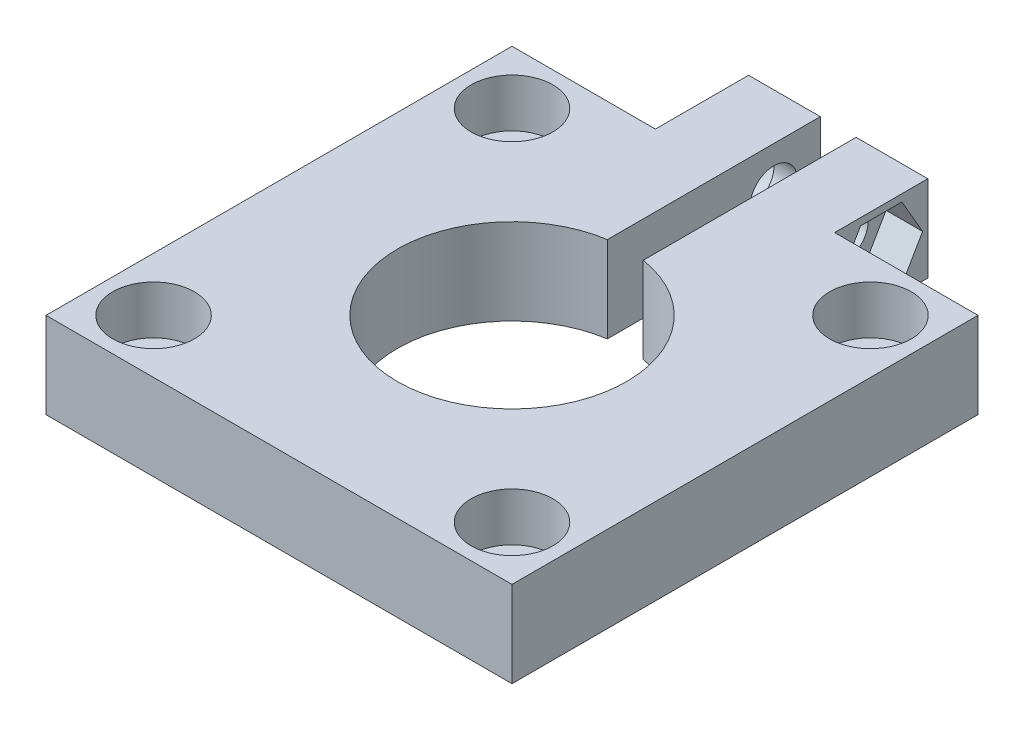
from build123d import *

# Parameters (mm, degrees)
SKETCH1_W                                           = 65
SKETCH1_H                                           = 65
BOSS_EXTRUDE1_DEPTH                                 = 12
SKETCH3_R                                           = 16
CUT_EXTRUDE1_DEPTH                                  = 12
SKETCH4_W                                           = 5
SKETCH4_H                                           = 40
CUT_EXTRUDE2_DEPTH                                  = 12
SKETCH5_W                                           = 10
SKETCH5_H                                           = 13
BOSS_EXTRUDE4_DEPTH                                 = 12
LPATTERN1_COUNT                                     = 2
LPATTERN1_PITCH                                     = 15
CBORE_FOR_M6_HEX_SOCKET_HEAD_CAP_SCREW1_D           = 6.6
CBORE_FOR_M6_HEX_SOCKET_HEAD_CAP_SCREW1_CBORE_D     = 10.5
CBORE_FOR_M6_HEX_SOCKET_HEAD_CAP_SCREW1_CBORE_DEPTH = 6.75
CUT_EXTRUDE3_DEPTH                                  = 5.1
CBORE_FOR_M6_HEX_SOCKET_HEAD_CAP_SCREW2_D           = 7.5
CBORE_FOR_M6_HEX_SOCKET_HEAD_CAP_SCREW2_CBORE_D     = 11.4
CBORE_FOR_M6_HEX_SOCKET_HEAD_CAP_SCREW2_CBORE_DEPTH = 6.75
CBORE_FOR_M6_HEX_SOCKET_HEAD_CAP_SCREW3_D           = 7.5
CBORE_FOR_M6_HEX_SOCKET_HEAD_CAP_SCREW3_CBORE_D     = 11.4
CBORE_FOR_M6_HEX_SOCKET_HEAD_CAP_SCREW3_CBORE_DEPTH = 6.75
CBORE_FOR_M6_HEX_SOCKET_HEAD_CAP_SCREW4_D           = 7.5
CBORE_FOR_M6_HEX_SOCKET_HEAD_CAP_SCREW4_CBORE_D     = 11.4
CBORE_FOR_M6_HEX_SOCKET_HEAD_CAP_SCREW4_CBORE_DEPTH = 6.75
CBORE_FOR_M6_HEX_SOCKET_HEAD_CAP_SCREW5_D           = 7.5
CBORE_FOR_M6_HEX_SOCKET_HEAD_CAP_SCREW5_CBORE_D     = 11.4
CBORE_FOR_M6_HEX_SOCKET_HEAD_CAP_SCREW5_CBORE_DEPTH = 6.75


with BuildPart() as part:
    # Sketch1 → Boss-Extrude1 (new body)
    with BuildSketch(Plane(origin=(0, 0, 0), x_dir=(1, 0, 0), z_dir=(0, 1, 0))):
        Rectangle(SKETCH1_W, SKETCH1_H)
    extrude(amount=BOSS_EXTRUDE1_DEPTH)

    # Sketch3 → Cut-Extrude1 (cut)
    with BuildSketch(Plane(origin=(0, 12, 0), x_dir=(-1, 0, 0), z_dir=(0, 1, 0))):
        with Locations(Location((0, 0, 0), (0, 0, 90))):
            Circle(SKETCH3_R)
    extrude(amount=-CUT_EXTRUDE1_DEPTH, mode=Mode.SUBTRACT)

    # Sketch4 → Cut-Extrude2 (cut)
    with BuildSketch(Plane(origin=(0, 12, 0), x_dir=(-1, 0, 0), z_dir=(0, 1, 0))):
        with Locations((0, -32.5)):
            Rectangle(SKETCH4_W, SKETCH4_H)
    extrude(amount=-CUT_EXTRUDE2_DEPTH, mode=Mode.SUBTRACT)

    # Sketch5 → Boss-Extrude4 (add)
    with BuildSketch(Plane(origin=(0, 12, 0), x_dir=(-1, 0, 0), z_dir=(0, 1, 0))):
        with Locations((7.5, -39)):
            Rectangle(SKETCH5_W, SKETCH5_H)
    boss_extrude4 = extrude(amount=-BOSS_EXTRUDE4_DEPTH)

    # LPattern1: Boss-Extrude4 ×2
    with Locations(*[(i * LPATTERN1_PITCH, 0, 0) for i in range(1, LPATTERN1_COUNT)]):
        add(boss_extrude4)

    # CBORE for M6 Hex Socket Head Cap Screw1 (through all)
    with Locations(Plane.ZY.offset(12.5)):
        with Locations((-39, 6)):
            CounterBoreHole(CBORE_FOR_M6_HEX_SOCKET_HEAD_CAP_SCREW1_D / 2, CBORE_FOR_M6_HEX_SOCKET_HEAD_CAP_SCREW1_CBORE_D / 2, CBORE_FOR_M6_HEX_SOCKET_HEAD_CAP_SCREW1_CBORE_DEPTH)

    # Sketch9 → Cut-Extrude3 (cut)
    with BuildSketch(Plane(origin=(12.5, 0, 0), x_dir=(0, 0, -1), z_dir=(1, 0, 0))):
        Polygon((44.773502692, 6), (41.886751346, 11), (36.113248654, 11), (33.226497308, 6), (36.113248654, 1), (41.886751346, 1), align=None)
    extrude(amount=-CUT_EXTRUDE3_DEPTH, mode=Mode.SUBTRACT)

    # CBORE for M6 Hex Socket Head Cap Screw2 (through all)
    with Locations(Plane(origin=(0, 12, 0), x_dir=(-1, 0, 0), z_dir=(0, 1, 0))):
        with Locations((25, -25)):
            CounterBoreHole(CBORE_FOR_M6_HEX_SOCKET_HEAD_CAP_SCREW2_D / 2, CBORE_FOR_M6_HEX_SOCKET_HEAD_CAP_SCREW2_CBORE_D / 2, CBORE_FOR_M6_HEX_SOCKET_HEAD_CAP_SCREW2_CBORE_DEPTH)

    # CBORE for M6 Hex Socket Head Cap Screw3 (through all)
    with Locations(Plane(origin=(0, 12, 0), x_dir=(-1, 0, 0), z_dir=(0, 1, 0))):
        with Locations((-25, -25)):
            CounterBoreHole(CBORE_FOR_M6_HEX_SOCKET_HEAD_CAP_SCREW3_D / 2, CBORE_FOR_M6_HEX_SOCKET_HEAD_CAP_SCREW3_CBORE_D / 2, CBORE_FOR_M6_HEX_SOCKET_HEAD_CAP_SCREW3_CBORE_DEPTH)

    # CBORE for M6 Hex Socket Head Cap Screw4 (through all)
    with Locations(Plane(origin=(0, 12, 0), x_dir=(-1, 0, 0), z_dir=(0, 1, 0))):
        with Locations((-25, 25)):
            CounterBoreHole(CBORE_FOR_M6_HEX_SOCKET_HEAD_CAP_SCREW4_D / 2, CBORE_FOR_M6_HEX_SOCKET_HEAD_CAP_SCREW4_CBORE_D / 2, CBORE_FOR_M6_HEX_SOCKET_HEAD_CAP_SCREW4_CBORE_DEPTH)

    # CBORE for M6 Hex Socket Head Cap Screw5 (through all)
    with Locations(Plane(origin=(0, 12, 0), x_dir=(-1, 0, 0), z_dir=(0, 1, 0))):
        with Locations((25, 25)):
            CounterBoreHole(CBORE_FOR_M6_HEX_SOCKET_HEAD_CAP_SCREW5_D / 2, CBORE_FOR_M6_HEX_SOCKET_HEAD_CAP_SCREW5_CBORE_D / 2, CBORE_FOR_M6_HEX_SOCKET_HEAD_CAP_SCREW5_CBORE_DEPTH)


solid = part.part
